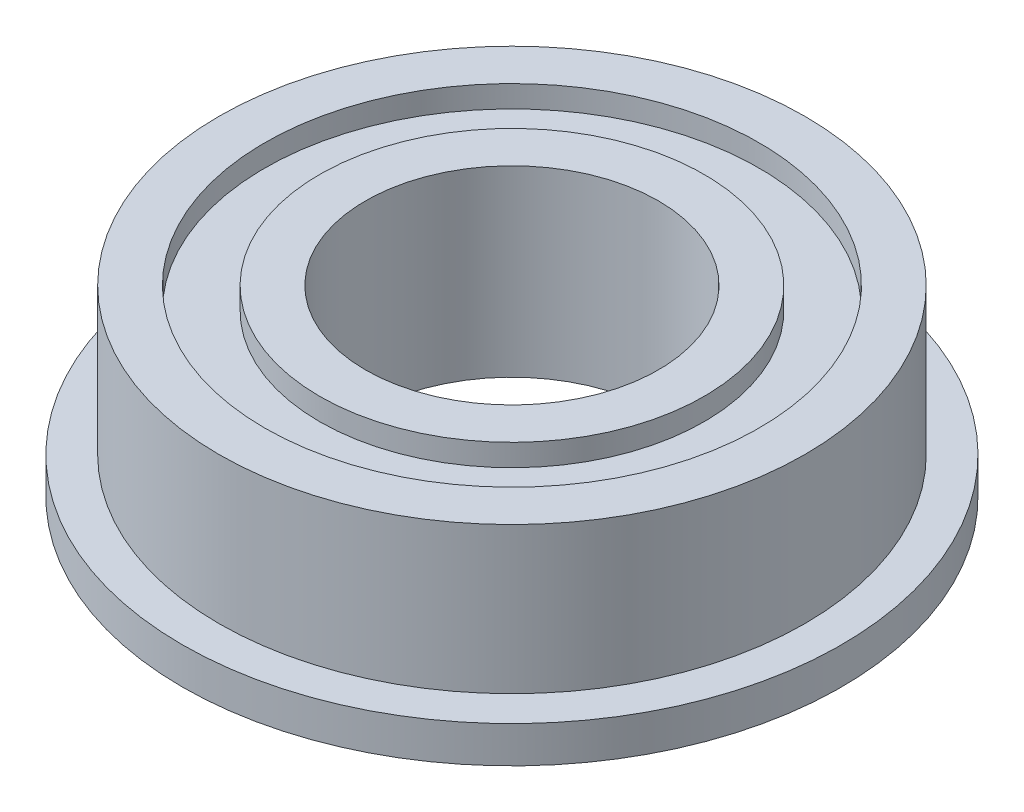
from build123d import *

# Parameters (mm, degrees)
SKETCH1_R           = 9
SKETCH1_R_2         = 4
BOSS_EXTRUDE1_DEPTH = 1
SKETCH2_R           = 8
SKETCH2_R_2         = 4
BOSS_EXTRUDE2_DEPTH = 4
SKETCH3_R           = 6.75
SKETCH3_R_2         = 5.25
CUT_EXTRUDE1_DEPTH  = 0.6
CUT_EXTRUDE2_START  = -0.6
SKETCH4_R           = 6.75
SKETCH4_R_2         = 5.25
CUT_EXTRUDE2_DEPTH  = 0.6


with BuildPart() as part:
    # Sketch1 → Boss-Extrude1 (new body)
    with BuildSketch(Plane(origin=(0, 0, 0), x_dir=(1, 0, 0), z_dir=(0, 1, 0))):
        with Locations(Location((0, 0, 0), (0, 0, 270))):
            Circle(SKETCH1_R)
        with Locations(Location((0, 0, 0), (0, 0, 270))):
            Circle(SKETCH1_R_2, mode=Mode.SUBTRACT)
    extrude(amount=BOSS_EXTRUDE1_DEPTH)

    # Sketch2 → Boss-Extrude2 (add)
    with BuildSketch(Plane(origin=(0, 1, 0), x_dir=(1, 0, 0), z_dir=(0, 1, 0))):
        with Locations(Location((0, 0, 0), (0, 0, 270))):
            Circle(SKETCH2_R)
        with Locations(Location((0, 0, 0), (0, 0, 270))):
            Circle(SKETCH2_R_2, mode=Mode.SUBTRACT)
    extrude(amount=BOSS_EXTRUDE2_DEPTH)

    # Sketch3 → Cut-Extrude1 (cut)
    with BuildSketch(Plane(origin=(0, 5, 0), x_dir=(1, 0, 0), z_dir=(0, 1, 0))):
        with Locations(Location((0, 0, 0), (0, 0, 270))):
            Circle(SKETCH3_R)
        with Locations(Location((0, 0, 0), (0, 0, 270))):
            Circle(SKETCH3_R_2, mode=Mode.SUBTRACT)
    extrude(amount=-CUT_EXTRUDE1_DEPTH, mode=Mode.SUBTRACT)

    # Sketch4 → Cut-Extrude2 (cut)
    with BuildSketch(Plane(origin=(0, 0, 0), x_dir=(-1, 0, 0), z_dir=(0, -1, 0)).offset(CUT_EXTRUDE2_START)):
        with Locations(Location((0, 0, 0), (0, 0, 270))):
            Circle(SKETCH4_R)
        with Locations(Location((0, 0, 0), (0, 0, 270))):
            Circle(SKETCH4_R_2, mode=Mode.SUBTRACT)
    extrude(amount=CUT_EXTRUDE2_DEPTH, mode=Mode.SUBTRACT)


solid = part.part
